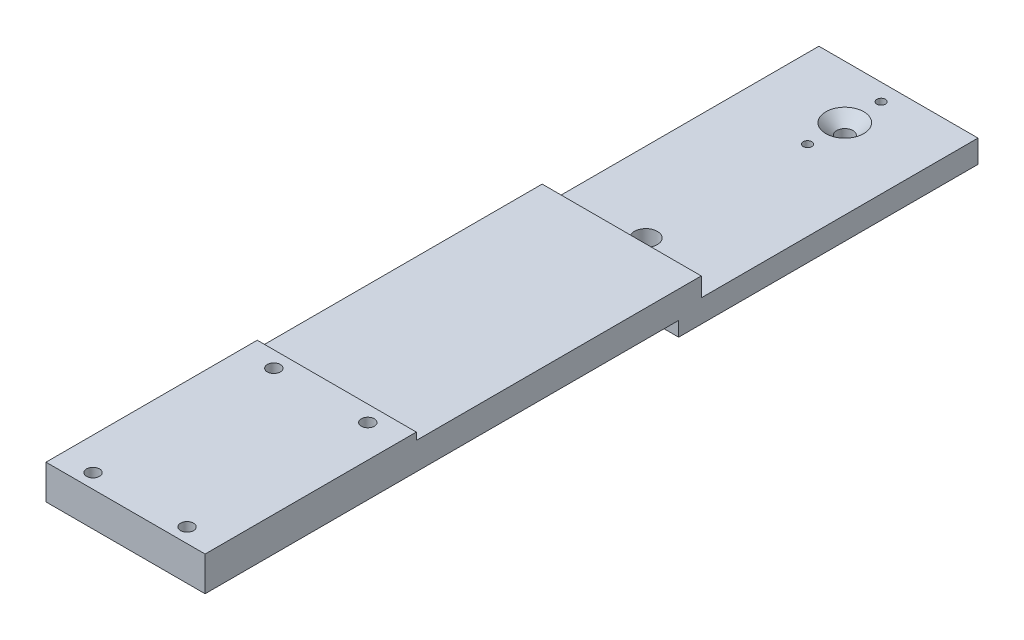
from build123d import *

# Parameters (mm, degrees)
SKETCH1_W                       = 44
SKETCH1_H                       = 162.947999986
EXTRUDE1_DEPTH                  = 9.525
SKETCH5_W                       = 44
SKETCH5_H                       = 104.527999986
EXTRUDE3_DEPTH                  = 2
SKETCH7_W                       = 44
SKETCH7_H                       = 25.735194666
EXTRUDE5_DEPTH                  = 5.25
SKETCH6_W                       = 44
SKETCH6_H                       = 31.986263093
EXTRUDE4_DEPTH                  = 4.032
F_1_4_0_25_DIAMETER_HOLE1_D     = 6.35
F_1_4_0_25_DIAMETER_HOLE1_DEPTH = 18.618
SKETCH8_W                       = 44
SKETCH8_H                       = 6.307
EXTRUDE6_DEPTH                  = 50.8
CBORE_FOR_M3_SBHCS1_D           = 3.6
CBORE_FOR_M3_SBHCS1_CBORE_D     = 6.7
CBORE_FOR_M3_SBHCS1_CBORE_DEPTH = 1.65
SKETCH12_R                      = 1.190625
CUT_EXTRUDE1_DEPTH              = 135.28690768
M4_CLEARANCE_HOLE1_D            = 4.5
M4_CLEARANCE_HOLE1_DEPTH        = 8.204
CHAMFER1_SIZE                   = 3


with BuildPart() as part:
    # Sketch1 → Extrude1 (new body)
    with BuildSketch(Plane(origin=(0, 0, 0), x_dir=(1, 0, 0), z_dir=(0, 1, 0))):
        Rectangle(SKETCH1_W, SKETCH1_H)
    extrude(amount=EXTRUDE1_DEPTH)

    # Sketch5 → Extrude3 (cut)
    with BuildSketch(Plane(origin=(0, 9.525, 0), x_dir=(1, 0, 0), z_dir=(0, 1, 0))):
        with Locations((0, 29.21)):
            Rectangle(SKETCH5_W, SKETCH5_H)
    extrude(amount=-EXTRUDE3_DEPTH, mode=Mode.SUBTRACT)

    # Sketch7 → Extrude5 (cut)
    with BuildSketch(Plane(origin=(0, 7.525, 0), x_dir=(1, 0, 0), z_dir=(0, 1, 0))):
        with Locations((0, 68.60640266)):
            Rectangle(SKETCH7_W, SKETCH7_H)
    extrude(amount=-EXTRUDE5_DEPTH, mode=Mode.SUBTRACT)

    # Sketch6 → Extrude4 (add)
    with BuildSketch(Plane.XZ):
        with Locations((0, -65.480868447)):
            Rectangle(SKETCH6_W, SKETCH6_H)
    extrude(amount=EXTRUDE4_DEPTH)

    # 1/4 (0.25) Diameter Hole1
    with Locations(Plane(origin=(-11.909442165, -4.032, 7.994157722), x_dir=(1, 0, 0), z_dir=(0, -1, 0))):
        with Locations((11.909442165, -70.418157729)):
            Hole(F_1_4_0_25_DIAMETER_HOLE1_D / 2, depth=F_1_4_0_25_DIAMETER_HOLE1_DEPTH)

    # Sketch8 → Extrude6 (add)
    with BuildSketch(Plane(origin=(0, 0, -81.473999993), x_dir=(-1, 0, 0), z_dir=(0, 0, -1))):
        with Locations((0, -0.8785)):
            Rectangle(SKETCH8_W, SKETCH8_H)
    extrude(amount=EXTRUDE6_DEPTH)

    # CBORE for M3 SBHCS1 (through all)
    with Locations(Plane.XZ):
        with Locations((-13, 77.473999993), (13, 77.473999993), (13, 27.473999993), (-13, 27.473999993)):
            CounterBoreHole(CBORE_FOR_M3_SBHCS1_D / 2, CBORE_FOR_M3_SBHCS1_CBORE_D / 2, CBORE_FOR_M3_SBHCS1_CBORE_DEPTH)

    # Sketch12 → Cut-Extrude1 (cut, through all)
    with BuildSketch(Plane(origin=(0, 2.275, 0), x_dir=(-1, 0, 0), z_dir=(0, 1, 0))):
        with Locations(Location((0.10007052, -127.574998873, 0), (0, 0, 90))):
            Circle(SKETCH12_R)
        with Locations(Location((0.10007052, -107.254998873, 0), (0, 0, 90))):
            Circle(SKETCH12_R)
    extrude(amount=-CUT_EXTRUDE1_DEPTH, mode=Mode.SUBTRACT)

    # M4 Clearance Hole1
    with Locations(Plane(origin=(0, 2.275, 0), x_dir=(-1, 0, 0), z_dir=(0, 1, 0))):
        with Locations((0.10007052, -117.540271762)):
            Hole(M4_CLEARANCE_HOLE1_D / 2, depth=M4_CLEARANCE_HOLE1_DEPTH)

    # Chamfer1
    chamfer1_edges = [part.edges().sort_by_distance(p)[0] for p in [
        (-2.35007052, 2.275, -117.540271762),
    ]]
    chamfer(chamfer1_edges, length=CHAMFER1_SIZE)


solid = part.part
